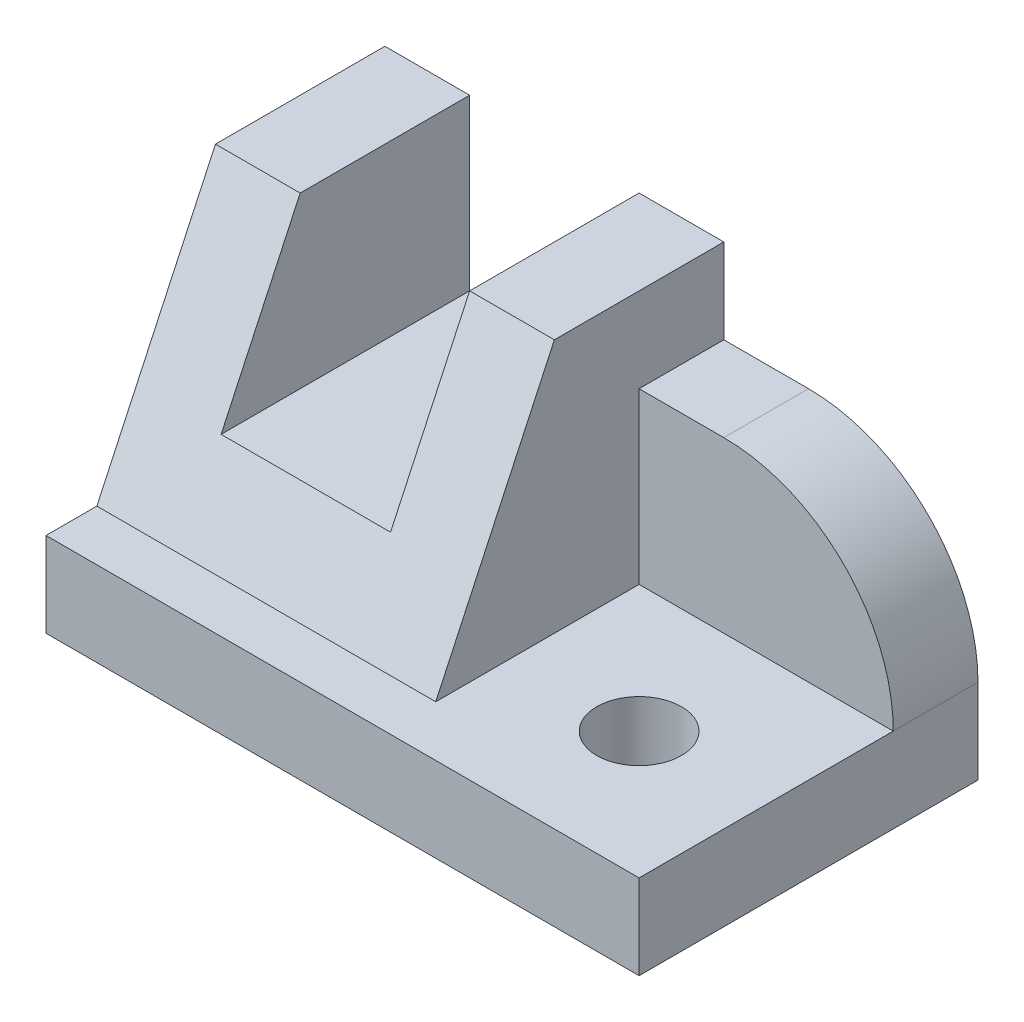
from build123d import *

# Parameters (mm, degrees)
BOSS_EXTRUDE1_DEPTH            = 40
SKETCH2_W                      = 40
SKETCH2_H                      = 30
BOSS_EXTRUDE2_DEPTH            = 20
BOSS_EXTRUDE3_DEPTH            = 30
CUT_EXTRUDE1_DEPTH             = 30
SKETCH5_W                      = 70
SKETCH5_H                      = 40
BOSS_EXTRUDE4_DEPTH            = 10
SKETCH6_W                      = 20
SKETCH6_H                      = 20
CUT_EXTRUDE2_DEPTH             = 91
F_10_0_10_DIAMETER_HOLE1_D     = 10
F_10_0_10_DIAMETER_HOLE1_DEPTH = 40
FILLET1_R                      = 20


with BuildPart() as part:
    # Sketch1 → Boss-Extrude1 (new body)
    with BuildSketch(Plane(origin=(0, 0, 0), x_dir=(0, -1, 0), z_dir=(-1, 0, 0))):
        Polygon((-10, -6), (-40, -20), (-10, -20), align=None)
    extrude(amount=-BOSS_EXTRUDE1_DEPTH)

    # Sketch2 → Boss-Extrude2 (add)
    with BuildSketch(Plane(origin=(0, 0, -20), x_dir=(-1, 0, 0), z_dir=(0, 0, -1))):
        with Locations((-20, 25)):
            Rectangle(SKETCH2_W, SKETCH2_H)
    extrude(amount=BOSS_EXTRUDE2_DEPTH)

    # Sketch3 → Boss-Extrude3 (add)
    with BuildSketch(Plane(origin=(40, 0, 0), x_dir=(0, 0, -1), z_dir=(1, 0, 0))):
        Polygon((40, 10), (0, 10), (20, 40), (40, 40), align=None)
    extrude(amount=BOSS_EXTRUDE3_DEPTH)

    # Sketch4 → Cut-Extrude1 (cut)
    with BuildSketch(Plane(origin=(70, 0, 0), x_dir=(0, 0, -1), z_dir=(1, 0, 0))):
        Polygon((20, 40), (0, 10), (30, 10), (30, 30), (40, 30), (40, 40), align=None)
    extrude(amount=-CUT_EXTRUDE1_DEPTH, mode=Mode.SUBTRACT)

    # Sketch5 → Boss-Extrude4 (add)
    with BuildSketch(Plane.XZ.offset(-10)):
        with Locations((35, -20)):
            Rectangle(SKETCH5_W, SKETCH5_H)
    extrude(amount=BOSS_EXTRUDE4_DEPTH)

    # Sketch6 → Cut-Extrude2 (cut, through all)
    with BuildSketch(Plane(origin=(0, 0, -40), x_dir=(-1, 0, 0), z_dir=(0, 0, -1))):
        with Locations((-20, 30)):
            Rectangle(SKETCH6_W, SKETCH6_H)
    extrude(amount=-CUT_EXTRUDE2_DEPTH, mode=Mode.SUBTRACT)

    # Ø10.0 (10) Diameter Hole1
    with Locations(Plane(origin=(0, 0, 0), x_dir=(-1, 0, 0), z_dir=(0, -1, 0))):
        with Locations((-55, 15)):
            Hole(F_10_0_10_DIAMETER_HOLE1_D / 2, depth=F_10_0_10_DIAMETER_HOLE1_DEPTH)

    # Fillet1
    fillet1_edges = [part.edges().sort_by_distance(p)[0] for p in [
        (70, 30, -35),
    ]]
    fillet(fillet1_edges, radius=FILLET1_R)


solid = part.part
